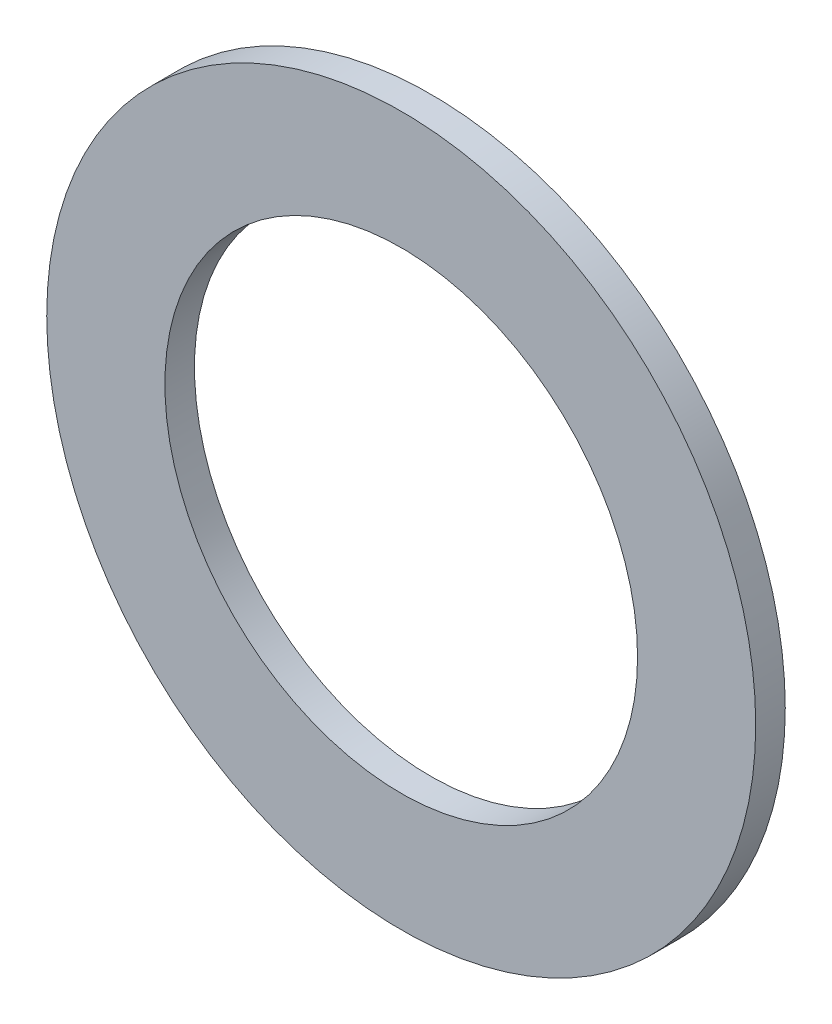
from build123d import *

# Parameters (mm, degrees)
SKETCH1_R           = 12
BOSS_EXTRUDE1_DEPTH = 1
SKETCH2_R           = 8
CUT_EXTRUDE1_DEPTH  = 1


with BuildPart() as part:
    # Sketch1 → Boss-Extrude1 (new body)
    with BuildSketch(Plane.XY):
        Circle(SKETCH1_R)
    extrude(amount=BOSS_EXTRUDE1_DEPTH)

    # Sketch2 → Cut-Extrude1 (cut)
    with BuildSketch(Plane.XY.offset(1)):
        Circle(SKETCH2_R)
    extrude(amount=-CUT_EXTRUDE1_DEPTH, mode=Mode.SUBTRACT)


solid = part.part
